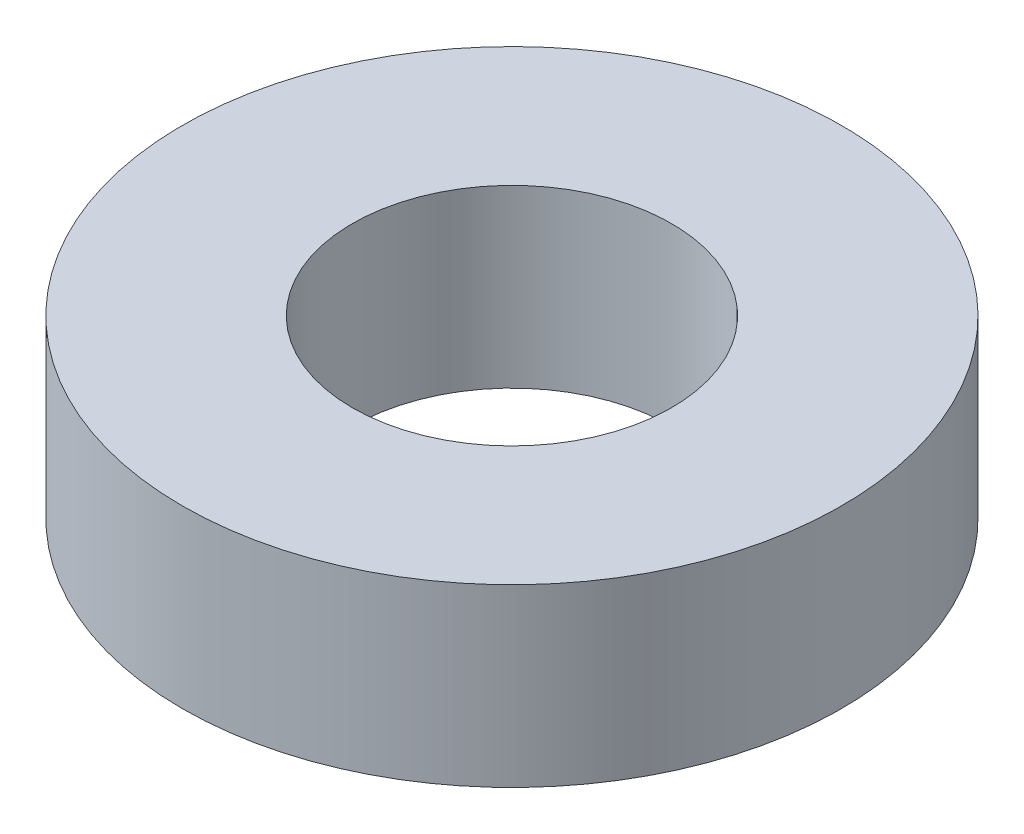
from build123d import *

# Parameters (mm, degrees)
SKETCH1_R           = 23.46
SKETCH1_R_2         = 11.36
BOSS_EXTRUDE1_DEPTH = 12.5


with BuildPart() as part:
    # Sketch1 → Boss-Extrude1 (new body)
    with BuildSketch(Plane(origin=(0, 0, 0), x_dir=(1, 0, 0), z_dir=(0, 1, 0))):
        with Locations(Location((0, 0, 0), (0, 0, 270))):
            Circle(SKETCH1_R)
        with Locations(Location((0, 0, 0), (0, 0, 270))):
            Circle(SKETCH1_R_2, mode=Mode.SUBTRACT)
    extrude(amount=BOSS_EXTRUDE1_DEPTH)


solid = part.part
